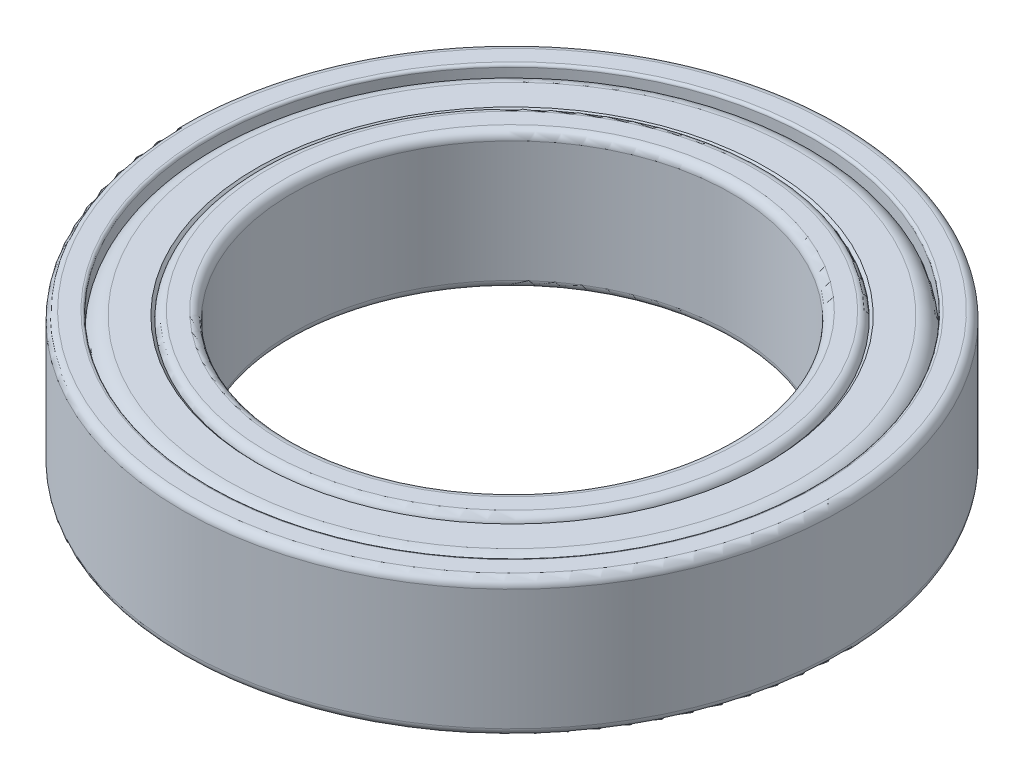
from build123d import *

# Parameters (mm, degrees)
SKETCH1_R             = 6
SKETCH1_R_2           = 5.5
BOSS_EXTRUDE1_DEPTH   = 1.25
SKETCH1_R_3           = 4.6
SKETCH1_R_4           = 4
BOSS_EXTRUDE1_2_DEPTH = 1.25
FILLET1_R             = 0.15
FILLET2_R             = 0.15
FILLET3_R             = 0.05
SKETCH2_R             = 5.5
SKETCH2_R_2           = 4.6
BOSS_EXTRUDE2_DEPTH   = 1.175
FILLET4_R             = 0.3
CHAMFER1_SIZE         = 0.05


with BuildPart() as part:
    # Sketch1 → Boss-Extrude1 (new, symmetric)
    with BuildSketch(Plane(origin=(0, 0, 0), x_dir=(1, 0, 0), z_dir=(0, 1, 0))):
        with Locations(Location((0, 0, 0), (0, 0, 270))):
            Circle(SKETCH1_R)
        with Locations(Location((0, 0, 0), (0, 0, 270))):
            Circle(SKETCH1_R_2, mode=Mode.SUBTRACT)
    extrude(amount=BOSS_EXTRUDE1_DEPTH, both=True)

    # Fillet2
    fillet2_edges = [part.edges().sort_by_distance(p)[0] for p in [
        (0, 1.25, -6),
        (0, -1.25, -6),
    ]]
    fillet(fillet2_edges, radius=FILLET2_R)

    # Fillet3
    fillet3_edges = [part.edges().sort_by_distance(p)[0] for p in [
        (0, -1.25, -5.5),
        (0, 1.25, -5.5),
    ]]
    fillet(fillet3_edges, radius=FILLET3_R)


with BuildPart() as body_2:
    # Sketch1 → Boss-Extrude1 2 (new, symmetric)
    with BuildSketch(Plane(origin=(0, 0, 0), x_dir=(1, 0, 0), z_dir=(0, 1, 0))):
        with Locations(Location((0, 0, 0), (0, 0, 270))):
            Circle(SKETCH1_R_3)
        with Locations(Location((0, 0, 0), (0, 0, 270))):
            Circle(SKETCH1_R_4, mode=Mode.SUBTRACT)
    extrude(amount=BOSS_EXTRUDE1_2_DEPTH, both=True)

    # Fillet1
    fillet1_edges = [body_2.edges().sort_by_distance(p)[0] for p in [
        (0, 1.25, -4.6),
        (0, -1.25, -4.6),
        (0, -1.25, -4),
        (0, 1.25, -4),
    ]]
    fillet(fillet1_edges, radius=FILLET1_R)


with BuildPart() as body_3:
    # Sketch2 → Boss-Extrude2 (new, symmetric)
    with BuildSketch(Plane(origin=(0, 0, 0), x_dir=(1, 0, 0), z_dir=(0, 1, 0))):
        with Locations(Location((0, 0, 0), (0, 0, 270))):
            Circle(SKETCH2_R)
        with Locations(Location((0, 0, 0), (0, 0, 270))):
            Circle(SKETCH2_R_2, mode=Mode.SUBTRACT)
    extrude(amount=BOSS_EXTRUDE2_DEPTH, both=True)

    # Fillet4
    fillet4_edges = [body_3.edges().sort_by_distance(p)[0] for p in [
        (0, -1.175, -5.5),
        (0, 1.175, -5.5),
    ]]
    fillet(fillet4_edges, radius=FILLET4_R)

    # Chamfer1
    chamfer1_edges = [body_3.edges().sort_by_distance(p)[0] for p in [
        (0, -1.175, -4.6),
        (0, 1.175, -4.6),
    ]]
    chamfer(chamfer1_edges, length=CHAMFER1_SIZE)


solid = Compound([part.part, body_2.part, body_3.part])
